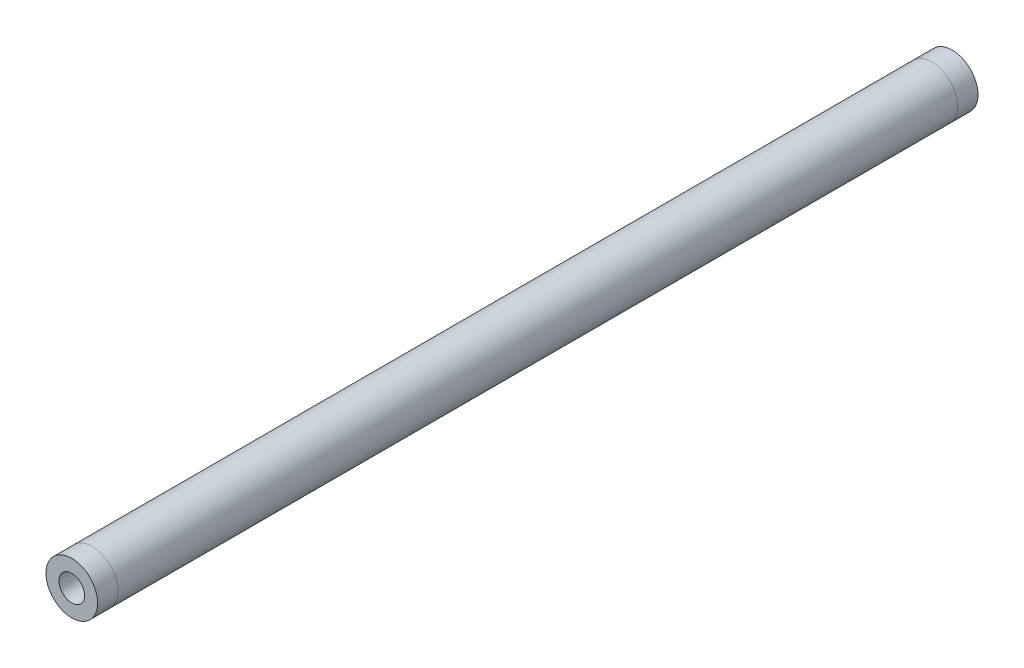
from build123d import *

# Parameters (mm, degrees)
SKETCH1_R                 = 8.001
SKETCH1_R_2               = 6.477
SKETCH1_R_3               = 3.96875
THREADED_INSERT_1_1_DEPTH = 6.35
THREADED_START            = -6.35
SKETCH1_3_R               = 6.477
SKETCH1_3_R_2             = 3.96875
THREADED_INSERT_1_2_DEPTH = 9.525
TUBE_START                = -6.35
SKETCH1_4_R               = 8.001
SKETCH1_4_R_2             = 6.477
TUBE_EXTRUDE_DEPTH        = 260.061986
THREADED_START_2          = -266.411986
SKETCH1_6_R               = 6.477
SKETCH1_6_R_2             = 3.96875
THREADED_INSERT_2_1_DEPTH = 9.525
SKETCH1_9_R               = 8.001
SKETCH1_9_R_2             = 6.477
SKETCH1_9_R_3             = 3.96875
THREADED_INSERT_2_2_DEPTH = 6.35


with BuildPart() as part:
    # Sketch1 → Threaded insert 1-1 (new body)
    # profile 1 of 2: a face of its own
    with BuildSketch(Plane.XY):
        Circle(SKETCH1_R)
        Circle(SKETCH1_R_2, mode=Mode.SUBTRACT)
    # profile 2 of 2: a face of its own
    with BuildSketch(Plane.XY):
        Circle(SKETCH1_R_2)
        Circle(SKETCH1_R_3, mode=Mode.SUBTRACT)
    extrude(amount=-THREADED_INSERT_1_1_DEPTH)

    # Sketch1<3> → Threaded insert 1-2 (add)
    with BuildSketch(Plane.XY.offset(THREADED_START)):
        Circle(SKETCH1_3_R)
        Circle(SKETCH1_3_R_2, mode=Mode.SUBTRACT)
    extrude(amount=-THREADED_INSERT_1_2_DEPTH)


with BuildPart() as body_2:
    # Sketch1<4> → Tube extrude (new body)
    with BuildSketch(Plane.XY.offset(TUBE_START)):
        Circle(SKETCH1_4_R)
        Circle(SKETCH1_4_R_2, mode=Mode.SUBTRACT)
    extrude(amount=-TUBE_EXTRUDE_DEPTH)


with BuildPart() as body_3:
    # Sketch1<6> → Threaded insert 2-1 (new body)
    with BuildSketch(Plane.XY.offset(THREADED_START_2)):
        Circle(SKETCH1_6_R)
        Circle(SKETCH1_6_R_2, mode=Mode.SUBTRACT)
    extrude(amount=THREADED_INSERT_2_1_DEPTH)


with BuildPart() as body_4:
    # Sketch1<9> → Threaded insert 2-2 (new body)
    # profile 1 of 2: a face of its own
    with BuildSketch(Plane.XY.offset(THREADED_START_2)):
        Circle(SKETCH1_9_R)
        Circle(SKETCH1_9_R_2, mode=Mode.SUBTRACT)
    # profile 2 of 2: a face of its own
    with BuildSketch(Plane.XY.offset(THREADED_START_2)):
        Circle(SKETCH1_9_R_2)
        Circle(SKETCH1_9_R_3, mode=Mode.SUBTRACT)
    extrude(amount=-THREADED_INSERT_2_2_DEPTH)

    # Combine1: union body 3
    add(body_3.part)


solid = Compound([part.part, body_2.part, body_4.part])
